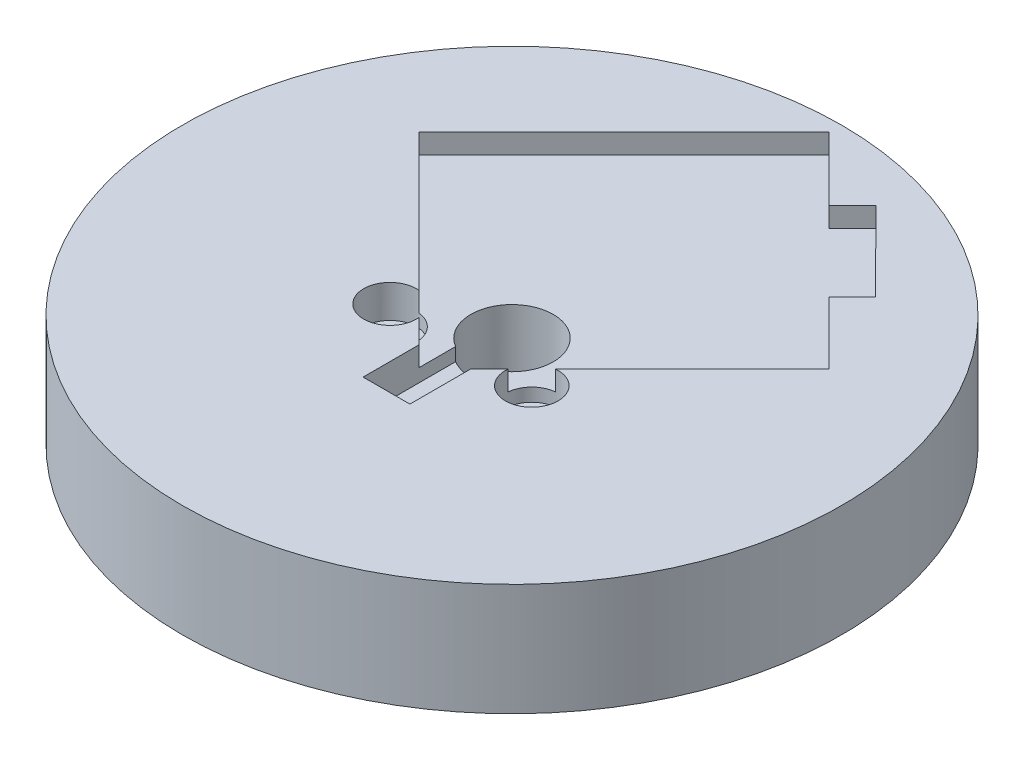
from build123d import *

# Parameters (mm, degrees)
SKETCH2_R           = 50
BOSS_EXTRUDE1_DEPTH = 17
SKETCH4_R           = 6.25
CUT_EXTRUDE1_DEPTH  = 17
SKETCH7_R           = 4
CUT_EXTRUDE2_DEPTH  = 5
SKETCH8_W           = 7.099474729
SKETCH8_H           = 14.03212915
CUT_EXTRUDE3_DEPTH  = 5
CUT_EXTRUDE4_DEPTH  = 3
CUT_EXTRUDE5_DEPTH  = 3


with BuildPart() as part:
    # Sketch2 → Boss-Extrude1 (new body)
    with BuildSketch(Plane(origin=(0, 0, 0), x_dir=(1, 0, 0), z_dir=(0, 1, 0))):
        with Locations(Location((0, 0, 0), (0, 0, 270))):
            Circle(SKETCH2_R)
    extrude(amount=BOSS_EXTRUDE1_DEPTH)

    # Sketch4 → Cut-Extrude1 (cut)
    with BuildSketch(Plane(origin=(0, 17, 0), x_dir=(1, 0, 0), z_dir=(0, 1, 0))):
        with Locations(Location((0, 0, 0), (0, 0, 270))):
            Circle(SKETCH4_R)
    extrude(amount=-CUT_EXTRUDE1_DEPTH, mode=Mode.SUBTRACT)

    # Sketch7 → Cut-Extrude2 (cut)
    with BuildSketch(Plane(origin=(0, 17, 0), x_dir=(1, 0, 0), z_dir=(0, 1, 0))):
        with Locations(Location((-10.75, -7.75, 0), (0, 0, 270))):
            Circle(SKETCH7_R)
    cut_extrude2 = extrude(amount=-CUT_EXTRUDE2_DEPTH, mode=Mode.SUBTRACT)

    # Mirror1: Cut-Extrude2 across plane
    add(cut_extrude2.mirror(Plane(origin=(0, 0, 0), x_dir=(0, 0, 1), z_dir=(1, 0, 0))), mode=Mode.SUBTRACT)

    # Sketch8 → Cut-Extrude3 (cut)
    with BuildSketch(Plane(origin=(0, 17, 0), x_dir=(1, 0, 0), z_dir=(0, 1, 0))):
        with Locations((0.370179164, -12.396855376)):
            Rectangle(SKETCH8_W, SKETCH8_H)
    extrude(amount=-CUT_EXTRUDE3_DEPTH, mode=Mode.SUBTRACT)

    # Sketch9 → Cut-Extrude4 (cut)
    with BuildSketch(Plane(origin=(0, 17, 0), x_dir=(1, 0, 0), z_dir=(0, 1, 0))):
        Polygon((-31.112706744, 17), (-8.372e-06, 48.112698372), (31.11269, 17), (-8.372e-06, -14.112698372), align=None)
    extrude(amount=-CUT_EXTRUDE4_DEPTH, mode=Mode.SUBTRACT)

    # Sketch6 → Cut-Extrude5 (cut)
    with BuildSketch(Plane(origin=(0, 17, 0), x_dir=(1, 0, 0), z_dir=(0, 1, 0))):
        Polygon((-5.977874391, 23.042765738), (5.977874391, 10.957234262), (25.17254203, 29.945776443), (13.216793249, 42.03130792), align=None)
    extrude(amount=-CUT_EXTRUDE5_DEPTH, mode=Mode.SUBTRACT)


solid = part.part
